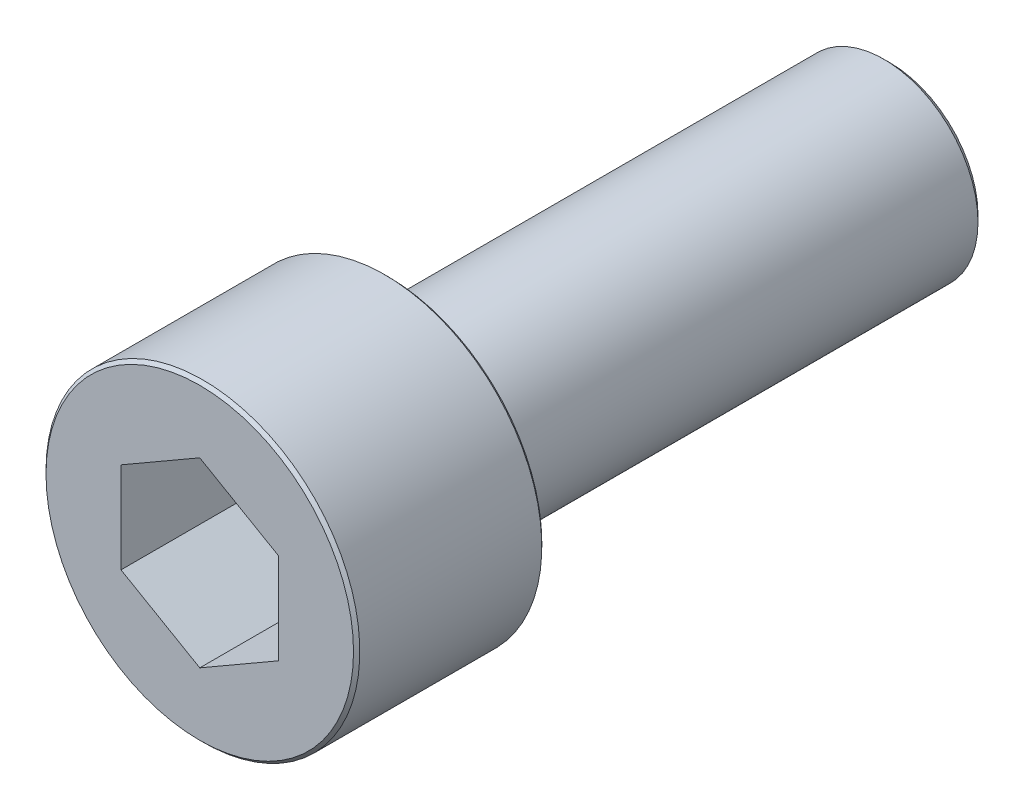
from build123d import *

# Parameters (mm, degrees)
SKETCH_1_W          = 5
SKETCH_1_H          = 6
SKETCH_2_R          = 3
EXTRUDE_1_DEPTH     = 16
CUT_EXTRUDE_1_DEPTH = 4.5
CHAMFER_1_SIZE2     = 0.099999625
CHAMFER_1_SIZE      = 0.099999668
CHAMFER_2_SIZE      = 0.200008974
CHAMFER_2_SIZE2     = 0.200009615


with BuildPart() as part:
    # 草图1 → 旋转1 (revolve)
    with BuildSketch(Plane(origin=(0, 0, 0), x_dir=(1, 0, 0), z_dir=(0, 1, 0))):
        with Locations((2.5, -19)):
            Rectangle(SKETCH_1_W, SKETCH_1_H)
    revolve(axis=Axis((0, 0, 16), (0, 0, 1)))

    # 草图2 → 凸台-拉伸1 (add)
    with BuildSketch(Plane(origin=(0, 0, 16), x_dir=(-1, 0, 0), z_dir=(0, 0, -1))):
        Circle(SKETCH_2_R)
    extrude(amount=EXTRUDE_1_DEPTH)

    # 草图3 → 切除-拉伸1 (cut)
    with BuildSketch(Plane.XY.offset(22)):
        Polygon((-2.51, -1.449149176), (0, -2.898298351), (2.51, -1.449149176), (2.51, 1.449149176), (0, 2.898298351), (-2.51, 1.449149176), align=None)
    extrude(amount=-CUT_EXTRUDE_1_DEPTH, mode=Mode.SUBTRACT)

    # 倒角1
    chamfer_1_edges = [part.edges().sort_by_distance(p)[0] for p in [
        (-5, 0, 22),
        (-5, 0, 16),
    ]]
    chamfer(chamfer_1_edges, length=CHAMFER_1_SIZE, length2=CHAMFER_1_SIZE2)

    # 倒角2
    chamfer_2_edges = [part.edges().sort_by_distance(p)[0] for p in [
        (3, 0, 0),
    ]]
    chamfer_2_side = [part.faces().sort_by_distance(p)[0] for p in [
        (3, 0, 8),
    ]]
    chamfer(chamfer_2_edges, length=CHAMFER_2_SIZE, length2=CHAMFER_2_SIZE2, reference=chamfer_2_side[0])


solid = part.part
